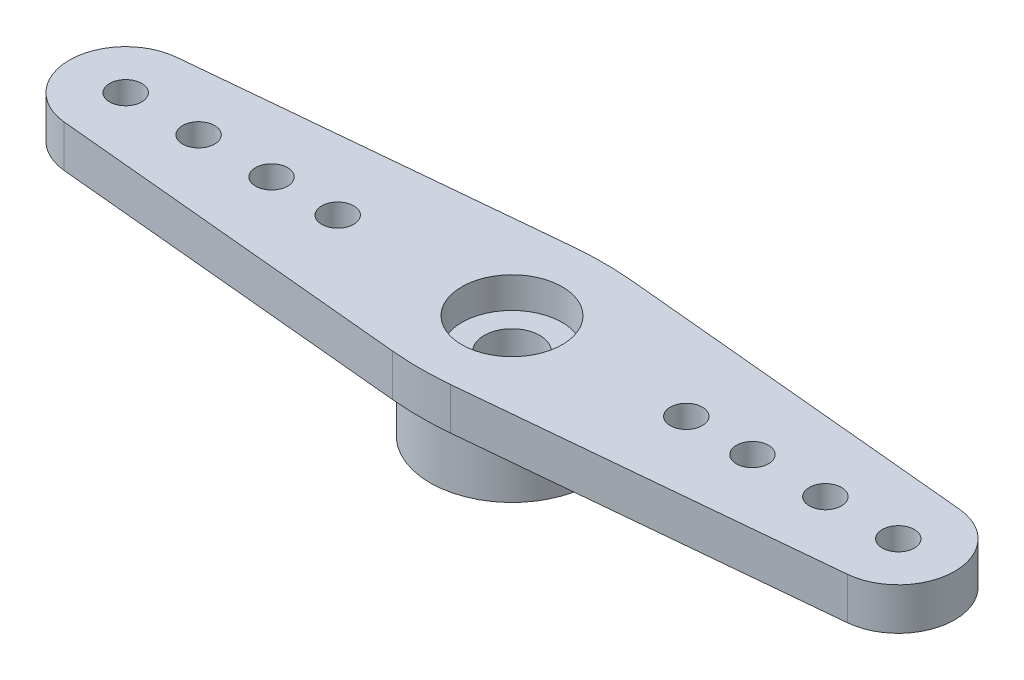
from build123d import *
from build123d.topology import SkipClean

# Parameters (mm, degrees)
SKETCH1_R                = 3.3655
SKETCH1_R_2              = 2.2352
BOSS_EXTRUDE1_DEPTH      = 2.54
SKETCH2_R                = 0.6604
SKETCH2_R_2              = 2.31775
SKETCH2_R_3              = 3.3655
SKETCH2_R_4              = 2.2352
SKETCH2_R_5              = 1.143
BOSS_EXTRUDE2_DEPTH      = 1.7272
FILLET1_R                = 12.7
CUT_EXTRUDE1_START       = -1.27
SKETCH3_R                = 2.06375
SKETCH3_R_2              = 1.143
CUT_EXTRUDE1_DEPTH       = 1.27
RESSALTO_EXTRUS_O1_START = 3.27
ESBO_O1_R                = 2.2352
ESBO_O1_R_2              = 1.143
RESSALTO_EXTRUS_O1_DEPTH = 3.27


with BuildPart() as part:
    # Sketch1 → Boss-Extrude1 (new body)
    with BuildSketch(Plane(origin=(0, 0, 0), x_dir=(1, 0, 0), z_dir=(0, 1, 0))):
        with Locations(Location((0, 0, 0), (0, 0, 270))):
            Circle(SKETCH1_R)
        with Locations(Location((0, 0, 0), (0, 0, 270))):
            Circle(SKETCH1_R_2, mode=Mode.SUBTRACT)
    extrude(amount=BOSS_EXTRUDE1_DEPTH)

    # Sketch2 → Boss-Extrude2 (add)
    # profile 1 of 7: a face of its own
    with BuildSketch(Plane(origin=(0, 2.54, 0), x_dir=(1, 0, 0), z_dir=(0, 1, 0))):
        with BuildLine():
            ThreePointArc((-0.713521748, -3.755518873), (-3.8227, 0), (-0.713521748, 3.755518873))
            Line((-0.713521748, 3.755518873), (-16.092265178, 2.307544345))
            ThreePointArc((-16.092265178, 2.307544345), (-14.314807913, 1.713991165), (-13.55725, 0))
            ThreePointArc((-13.55725, 0), (-14.314807913, -1.713991165), (-16.092265178, -2.307544345))
            Line((-16.092265178, -2.307544345), (-0.713521748, -3.755518873))
        make_face()
        with Locations(Location((-12.8778, 0, 0), (0, 0, 270))):
            Circle(SKETCH2_R, mode=Mode.SUBTRACT)
        with Locations(Location((-9.8806, 0, 0), (0, 0, 270))):
            Circle(SKETCH2_R, mode=Mode.SUBTRACT)
        with Locations(Location((-7.1628, 0, 0), (0, 0, 270))):
            Circle(SKETCH2_R, mode=Mode.SUBTRACT)
    # profile 2 of 7: a face of its own
    with BuildSketch(Plane(origin=(0, 2.54, 0), x_dir=(1, 0, 0), z_dir=(0, 1, 0))):
        with Locations((-15.875, 0)):
            Circle(SKETCH2_R_2)
        with Locations(Location((-15.875, 0, 0), (0, 0, 270))):
            Circle(SKETCH2_R, mode=Mode.SUBTRACT)
    # profile 3 of 7: a face of its own
    with BuildSketch(Plane(origin=(0, 2.54, 0), x_dir=(1, 0, 0), z_dir=(0, 1, 0))):
        with BuildLine():
            Line((16.092265178, 2.307544345), (0.713521748, 3.755518873))
            ThreePointArc((0.713521748, 3.755518873), (2.944538578, 2.437771083), (3.8227, 0))
            ThreePointArc((3.8227, 0), (2.944538578, -2.437771083), (0.713521748, -3.755518873))
            Line((0.713521748, -3.755518873), (16.092265178, -2.307544345))
            ThreePointArc((16.092265178, -2.307544345), (13.55725, 0), (16.092265178, 2.307544345))
        make_face()
        with Locations(Location((7.1628, 0, 0), (0, 0, 270))):
            Circle(SKETCH2_R, mode=Mode.SUBTRACT)
        with Locations(Location((9.8806, 0, 0), (0, 0, 270))):
            Circle(SKETCH2_R, mode=Mode.SUBTRACT)
        with Locations(Location((12.8778, 0, 0), (0, 0, 270))):
            Circle(SKETCH2_R, mode=Mode.SUBTRACT)
    # profile 4 of 7: a face of its own
    with BuildSketch(Plane(origin=(0, 2.54, 0), x_dir=(1, 0, 0), z_dir=(0, 1, 0))):
        with Locations((15.875, 0)):
            Circle(SKETCH2_R_2)
        with Locations(Location((15.875, 0, 0), (0, 0, 270))):
            Circle(SKETCH2_R, mode=Mode.SUBTRACT)
    # profile 5 of 7: a face of its own
    with BuildSketch(Plane(origin=(0, 2.54, 0), x_dir=(1, 0, 0), z_dir=(0, 1, 0))):
        with BuildLine():
            Line((0.713521748, 3.755518873), (0, 3.8227))
            Line((0, 3.8227), (-0.713521748, 3.755518873))
            ThreePointArc((-0.713521748, 3.755518873), (-3.8227, 0), (-0.713521748, -3.755518873))
            Line((-0.713521748, -3.755518873), (0, -3.8227))
            Line((0, -3.8227), (0.713521748, -3.755518873))
            ThreePointArc((0.713521748, -3.755518873), (2.944538578, -2.437771083), (3.8227, 0))
            ThreePointArc((3.8227, 0), (2.944538578, 2.437771083), (0.713521748, 3.755518873))
        make_face()
        with Locations(Location((0, 0, 0), (0, 0, 270))):
            Circle(SKETCH2_R_3, mode=Mode.SUBTRACT)
    # profile 6 of 7: a face of its own
    with BuildSketch(Plane(origin=(0, 2.54, 0), x_dir=(1, 0, 0), z_dir=(0, 1, 0))):
        with Locations(Location((0, 0, 0), (0, 0, 270))):
            Circle(SKETCH2_R_3)
        with Locations(Location((0, 0, 0), (0, 0, 270))):
            Circle(SKETCH2_R_4, mode=Mode.SUBTRACT)
    # profile 7 of 7: a face of its own
    with BuildSketch(Plane(origin=(0, 2.54, 0), x_dir=(1, 0, 0), z_dir=(0, 1, 0))):
        with Locations(Location((0, 0, 0), (0, 0, 270))):
            Circle(SKETCH2_R_4)
        with Locations(Location((0, 0, 0), (0, 0, 270))):
            Circle(SKETCH2_R_5, mode=Mode.SUBTRACT)
    extrude(amount=BOSS_EXTRUDE2_DEPTH)

    # Fillet1
    fillet1_edges = [part.edges().sort_by_distance(p)[0] for p in [
        (0, 3.4036, -3.8227),
        (0, 3.4036, 3.8227),
    ]]
    fillet(fillet1_edges, radius=FILLET1_R)

    # Sketch3 → Cut-Extrude1 (cut)
    with BuildSketch(Plane(origin=(0, 4.2672, 0), x_dir=(1, 0, 0), z_dir=(0, 1, 0)).offset(CUT_EXTRUDE1_START)):
        with Locations(Location((0, 0, 0), (0, 0, 270))):
            Circle(SKETCH3_R)
        with Locations(Location((0, 0, 0), (0, 0, 270))):
            Circle(SKETCH3_R_2, mode=Mode.SUBTRACT)
    extrude(amount=CUT_EXTRUDE1_DEPTH, mode=Mode.SUBTRACT)

    # Esboço1 → Ressalto-extrusão1 (add)
    with SkipClean():  # the faces are left unmerged after this step: merging them gives an invalid solid
        with BuildSketch(Plane.XZ.offset(-2.54).offset(RESSALTO_EXTRUS_O1_START)):
            with Locations(Location((0, 0, 0), (0, 0, 90))):
                Circle(ESBO_O1_R)
            with Locations(Location((0, 0, 0), (0, 0, 270))):
                Circle(ESBO_O1_R_2, mode=Mode.SUBTRACT)
        extrude(amount=-RESSALTO_EXTRUS_O1_DEPTH)


solid = part.part
